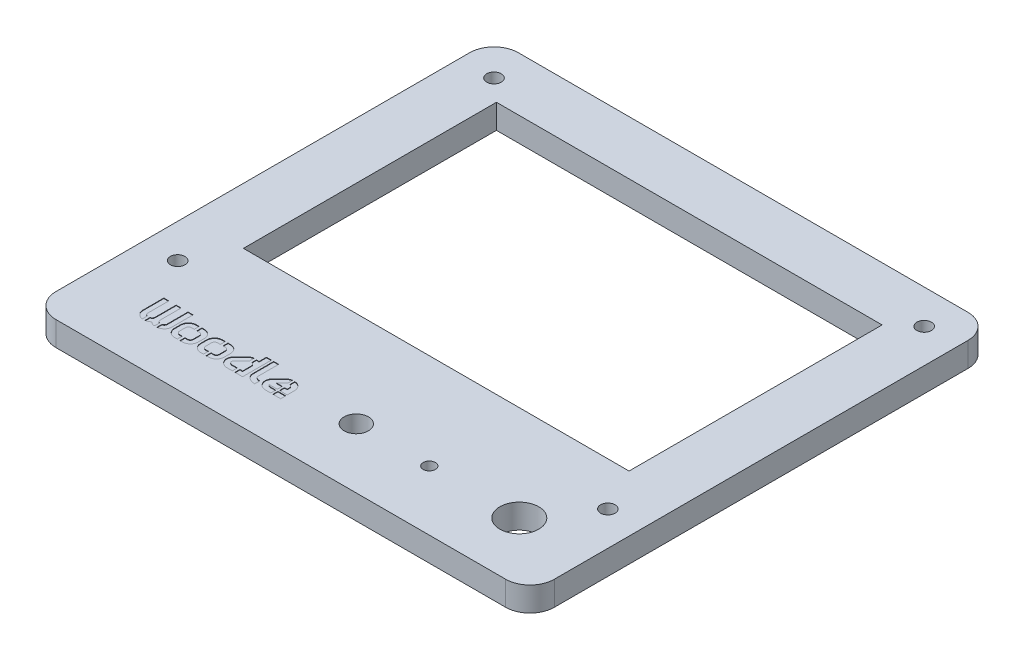
from build123d import *

# Parameters (mm, degrees)
SKETCH1_W           = 102.4
SKETCH1_H           = 95
SKETCH1_R           = 4
SKETCH1_R_2         = 1.5
SKETCH1_R_3         = 2.5
SKETCH1_R_4         = 1.25
SKETCH1_W_2         = 79.25
SKETCH1_H_2         = 52
BOSS_EXTRUDE1_DEPTH = 5
CUT_EXTRUDE1_DEPTH  = 0.1
FILLET1_R           = 5


with BuildPart() as part:
    # Sketch1 → Boss-Extrude1 (new body)
    with BuildSketch(Plane(origin=(0, 0, 0), x_dir=(1, 0, 0), z_dir=(0, 1, 0))):
        with Locations((0, -10.43)):
            Rectangle(SKETCH1_W, SKETCH1_H)
        with Locations(Location((36.7, -45.63, 0), (0, 0, 270))):
            Circle(SKETCH1_R, mode=Mode.SUBTRACT)
        with Locations(Location((-44.2, 30.07, 0), (0, 0, 270))):
            Circle(SKETCH1_R_2, mode=Mode.SUBTRACT)
        with Locations(Location((44.2, 30.07, 0), (0, 0, 270))):
            Circle(SKETCH1_R_2, mode=Mode.SUBTRACT)
        with Locations(Location((44.2, -34.93, 0), (0, 0, 270))):
            Circle(SKETCH1_R_2, mode=Mode.SUBTRACT)
        with Locations(Location((-44.2, -34.93, 0), (0, 0, 270))):
            Circle(SKETCH1_R_2, mode=Mode.SUBTRACT)
        with Locations(Location((3.2, -45.63, 0), (0, 0, 270))):
            Circle(SKETCH1_R_3, mode=Mode.SUBTRACT)
        with Locations(Location((18.2, -45.63, 0), (0, 0, 270))):
            Circle(SKETCH1_R_4, mode=Mode.SUBTRACT)
        Rectangle(SKETCH1_W_2, SKETCH1_H_2, mode=Mode.SUBTRACT)
    extrude(amount=BOSS_EXTRUDE1_DEPTH)

    # Sketch3 → Cut-Extrude1 (cut)
    with BuildSketch(Plane(origin=(0, 5, 0), x_dir=(1, 0, 0), z_dir=(0, 1, 0))):
        with BuildLine():
            add(Edge.make_bspline(
                [(-35.410526316, -47.317746711), (-35.409269236, -47.35079818), (-35.406784624, -47.416124246), (-35.381879918, -47.511001002), (-35.343551504, -47.601331044), (-35.289120642, -47.684190592), (-35.223509966, -47.758732759), (-35.145322275, -47.817499486), (-35.060801397, -47.866996704), (-34.998218698, -47.885603326), (-34.966447368, -47.895049342)],
                knots=[0, 0, 0, 0, 1.010227084, 1.996708827, 2.983833333, 4.003745822, 5.020232118, 6.007597553, 6.988517975, 8, 8, 8, 8], degree=3))
            Line((-34.966447368, -47.895049342), (-34.966447368, -48.93))
            add(Edge.make_bspline(
                [(-34.966447368, -48.93), (-35.012993201, -48.924417118), (-35.105344651, -48.913340138), (-35.241738224, -48.886497526), (-35.374212149, -48.847428211), (-35.503818383, -48.800067649), (-35.627944809, -48.740753756), (-35.746368401, -48.671724001), (-35.856804681, -48.589717308), (-35.924235419, -48.527267245), (-35.958223684, -48.495789474)],
                knots=[0, 0, 0, 0, 1.018810117, 2.021418134, 3.017070451, 4.018163531, 5.0176195, 6.003232589, 6.993535249, 8, 8, 8, 8], degree=3))
            add(Edge.make_bspline(
                [(-35.958223684, -48.495789474), (-36.02707741, -48.55013275), (-36.16623187, -48.659961363), (-36.363162428, -48.765074712), (-36.528631145, -48.833696509), (-36.656309169, -48.877973545), (-36.788203382, -48.909782822), (-36.877926518, -48.923253558), (-36.922861842, -48.93)],
                knots=[0, 0, 0, 0, 1.470266527, 2.97143169, 3.726468338, 4.477360312, 5.237428497, 6, 6, 6, 6], degree=3))
            Line((-36.922861842, -48.93), (-36.922861842, -47.895049342))
            add(Edge.make_bspline(
                [(-36.922861842, -47.895049342), (-36.889927853, -47.885501774), (-36.824404491, -47.866506541), (-36.734256781, -47.81771223), (-36.649935714, -47.758667854), (-36.577025401, -47.68454888), (-36.515271174, -47.601963717), (-36.470284079, -47.511809264), (-36.441330557, -47.416554863), (-36.438345654, -47.350845635), (-36.436842105, -47.317746711)],
                knots=[0, 0, 0, 0, 1.01260259, 2.014609424, 3.018094582, 4.051204175, 5.07884678, 6.058940596, 7.022253355, 8, 8, 8, 8], degree=3))
            Line((-36.436842105, -47.317746711), (-36.436842105, -43.008947368))
            Line((-36.436842105, -43.008947368), (-35.410526316, -43.008947368))
            Line((-35.410526316, -43.008947368), (-35.410526316, -47.317746711))
        make_face()
        with BuildLine():
            add(Edge.make_bspline(
                [(-32.963157895, -47.317746711), (-32.964801005, -47.369602358), (-32.968046871, -47.472040076), (-32.98727632, -47.624017964), (-33.024059613, -47.770618271), (-33.071860088, -47.912751867), (-33.132228537, -48.048841107), (-33.205338686, -48.176777092), (-33.288386095, -48.297890502), (-33.3832135, -48.409698478), (-33.488899271, -48.512497379), (-33.603258926, -48.606316279), (-33.727948807, -48.689906632), (-33.86181299, -48.761461736), (-34.002635133, -48.82452776), (-34.15121707, -48.871105124), (-34.304578797, -48.909979576), (-34.409915143, -48.923278165), (-34.463157895, -48.93)],
                knots=[0, 0, 0, 0, 1.028666461, 2.032068855, 3.03088781, 4.021147977, 5.003147261, 5.978214699, 6.939579792, 7.911675967, 8.88048293, 9.859905496, 10.84149838, 11.852230519, 12.867361305, 13.896318637, 14.936684362, 16, 16, 16, 16], degree=3))
            Line((-34.463157895, -48.93), (-34.463157895, -47.895049342))
            add(Edge.make_bspline(
                [(-34.463157895, -47.895049342), (-34.430211101, -47.885536669), (-34.365013133, -47.86671217), (-34.275919772, -47.818010073), (-34.193898432, -47.758507914), (-34.123271987, -47.684506294), (-34.06439912, -47.601494426), (-34.019874097, -47.511975309), (-33.994672793, -47.41614185), (-33.991219169, -47.350780677), (-33.989473684, -47.317746711)],
                knots=[0, 0, 0, 0, 1.022011913, 2.022445629, 3.015379681, 4.040857925, 5.06368216, 6.04744906, 7.013167921, 8, 8, 8, 8], degree=3))
            Line((-33.989473684, -47.317746711), (-33.989473684, -43.008947368))
            Line((-33.989473684, -43.008947368), (-32.963157895, -43.008947368))
            Line((-32.963157895, -43.008947368), (-32.963157895, -47.317746711))
        make_face()
        with BuildLine():
            add(Edge.make_bspline(
                [(-37.936842105, -47.317746711), (-37.935120096, -47.35079055), (-37.931712919, -47.416171258), (-37.906213049, -47.511686672), (-37.86325985, -47.601415851), (-37.805562279, -47.684858033), (-37.734808468, -47.758424076), (-37.652661119, -47.818380818), (-37.562459452, -47.86667324), (-37.496498966, -47.885521902), (-37.463157895, -47.895049342)],
                knots=[0, 0, 0, 0, 0.985573412, 1.950060536, 2.927269449, 3.941761156, 4.965931442, 5.957599044, 6.967626846, 8, 8, 8, 8], degree=3))
            Line((-37.463157895, -47.895049342), (-37.463157895, -48.93))
            add(Edge.make_bspline(
                [(-37.463157895, -48.93), (-37.513937746, -48.923254755), (-37.614789329, -48.909858326), (-37.76196025, -48.870947502), (-37.905547025, -48.824230369), (-38.04246227, -48.761600462), (-38.173090491, -48.688841116), (-38.297314104, -48.606534433), (-38.411593264, -48.511709109), (-38.519762405, -48.409914843), (-38.616761244, -48.297560219), (-38.703808224, -48.177002624), (-38.780180862, -48.048650256), (-38.845983798, -47.91322325), (-38.897530708, -47.770914548), (-38.936316648, -47.624126352), (-38.958949857, -47.472234993), (-38.961744677, -47.369629712), (-38.963157895, -47.317746711)],
                knots=[0, 0, 0, 0, 1.02041224, 2.026594961, 3.029967857, 4.028101524, 5.022727038, 6.009617966, 6.994326862, 7.980161472, 8.968175627, 9.948917217, 10.941614734, 11.942707234, 12.946482016, 13.954700296, 14.96578142, 16, 16, 16, 16], degree=3))
            Line((-38.963157895, -47.317746711), (-38.963157895, -43.008947368))
            Line((-38.963157895, -43.008947368), (-37.936842105, -43.008947368))
            Line((-37.936842105, -43.008947368), (-37.936842105, -47.317746711))
        make_face()
        with BuildLine():
            add(Edge.make_bspline(
                [(-30.806907895, -45.456315789), (-30.850723382, -45.458284893), (-30.936913644, -45.462158354), (-31.060957813, -45.497765045), (-31.174096916, -45.55726952), (-31.274111402, -45.637091712), (-31.358408414, -45.732009563), (-31.418461666, -45.840376686), (-31.456202659, -45.957560652), (-31.460815537, -46.039092601), (-31.463157895, -46.080493421)],
                knots=[0, 0, 0, 0, 1.043825976, 2.053329579, 3.049585033, 4.076299473, 5.091651461, 6.058032298, 7.013895072, 8, 8, 8, 8], degree=3))
            Line((-31.463157895, -46.080493421), (-31.463157895, -47.295542763))
            add(Edge.make_bspline(
                [(-31.463157895, -47.295542763), (-31.460755719, -47.335695536), (-31.456000756, -47.415175521), (-31.418805107, -47.529422126), (-31.357467061, -47.634470042), (-31.274540009, -47.728057399), (-31.173569002, -47.805084689), (-31.060910914, -47.863663436), (-30.93671203, -47.89750495), (-30.850692558, -47.901599864), (-30.806907895, -47.903684211)],
                knots=[0, 0, 0, 0, 0.968952361, 1.917982567, 2.870698946, 3.891457366, 4.918964356, 5.923292062, 6.942937516, 8, 8, 8, 8], degree=3))
            Line((-30.806907895, -47.903684211), (-30.277713816, -47.903684211))
            Line((-30.277713816, -47.903684211), (-30.277713816, -48.93))
            Line((-30.277713816, -48.93), (-30.806907895, -48.93))
            add(Edge.make_bspline(
                [(-30.806907895, -48.93), (-30.865775828, -48.92817462), (-30.981513408, -48.924585823), (-31.152412386, -48.901096276), (-31.316514628, -48.85970599), (-31.47472573, -48.804906279), (-31.622905189, -48.733980064), (-31.762743284, -48.653867232), (-31.891116993, -48.561052926), (-32.008948414, -48.457010453), (-32.115213567, -48.342150481), (-32.209695978, -48.216405988), (-32.292036204, -48.080760065), (-32.362743105, -47.936016143), (-32.419324745, -47.783657058), (-32.460484621, -47.625045637), (-32.48402667, -47.460721441), (-32.487641009, -47.349480923), (-32.489473684, -47.293075658)],
                knots=[0, 0, 0, 0, 1.080806525, 2.124924803, 3.159392374, 4.183645534, 5.193357222, 6.170922564, 7.138880151, 8.096181651, 9.052411011, 10.006611931, 10.978916479, 11.961395482, 12.959812438, 13.957687, 14.964431228, 16, 16, 16, 16], degree=3))
            Line((-32.489473684, -47.293075658), (-32.489473684, -46.075559211))
            add(Edge.make_bspline(
                [(-32.489473684, -46.075559211), (-32.487646725, -46.017919631), (-32.484042913, -45.904221284), (-32.460410138, -45.736255398), (-32.419819282, -45.57457679), (-32.362400138, -45.420051895), (-32.292365405, -45.273367094), (-32.210008194, -45.136407558), (-32.115202484, -45.010443075), (-32.008892646, -44.895675345), (-31.891531839, -44.791359845), (-31.762243298, -44.700311868), (-31.623571983, -44.619287783), (-31.474269541, -44.551826445), (-31.316538718, -44.497575009), (-31.152218857, -44.458112978), (-30.98157068, -44.433767538), (-30.865789053, -44.431270087), (-30.806907895, -44.43)],
                knots=[0, 0, 0, 0, 1.053003276, 2.077127084, 3.091951553, 4.09252401, 5.083718505, 6.05768351, 7.007210062, 7.958755116, 8.911367059, 9.870208281, 10.842984798, 11.841440058, 12.858208903, 13.885825724, 14.924829153, 16, 16, 16, 16], degree=3))
            Line((-30.806907895, -44.43), (-30.277713816, -44.43))
            Line((-30.277713816, -44.43), (-30.277713816, -45.456315789))
            Line((-30.277713816, -45.456315789), (-30.806907895, -45.456315789))
        make_face()
        with BuildLine():
            add(Edge.make_bspline(
                [(-29.235361842, -44.43), (-29.179364654, -44.431340086), (-29.068103292, -44.434002717), (-28.904306759, -44.457765462), (-28.745921582, -44.498020967), (-28.593475695, -44.551998405), (-28.448026802, -44.61967061), (-28.312138227, -44.69990226), (-28.186386682, -44.79187361), (-28.071370729, -44.895571736), (-27.967931328, -45.011300638), (-27.87265591, -45.135941642), (-27.792119257, -45.273786183), (-27.721710629, -45.419989593), (-27.664418487, -45.574593804), (-27.623793013, -45.736250792), (-27.600169525, -45.904222478), (-27.596564444, -46.017920033), (-27.594736842, -46.075559211)],
                knots=[0, 0, 0, 0, 1.037637347, 2.061691803, 3.059976681, 4.062877695, 5.055208535, 6.029101085, 6.983469214, 7.938689241, 8.893909267, 9.857365668, 10.841701768, 11.847437394, 12.862688559, 13.892400818, 14.93154884, 16, 16, 16, 16], degree=3))
            Line((-27.594736842, -46.075559211), (-27.594736842, -47.293075658))
            add(Edge.make_bspline(
                [(-27.594736842, -47.293075658), (-27.596570143, -47.349480529), (-27.600185716, -47.460720271), (-27.623718735, -47.625050149), (-27.664912438, -47.783640284), (-27.721368479, -47.936078403), (-27.792441333, -48.080341786), (-27.872968634, -48.216874729), (-27.967921693, -48.341291739), (-28.071313391, -48.457113666), (-28.186807841, -48.560547476), (-28.311630464, -48.654267709), (-28.448706798, -48.733604735), (-28.593017171, -48.80471943), (-28.745949801, -48.859253188), (-28.904103621, -48.901447646), (-29.068163472, -48.924344134), (-29.179378317, -48.92810623), (-29.235361842, -48.93)],
                knots=[0, 0, 0, 0, 1.050812842, 2.072376829, 3.084940585, 4.098054719, 5.094996286, 6.077650631, 7.045897848, 8.005867735, 8.965837622, 9.929498483, 10.908233743, 11.912067335, 12.92254273, 13.927690681, 14.956837279, 16, 16, 16, 16], degree=3))
            Line((-29.235361842, -48.93), (-29.721381579, -48.93))
            Line((-29.721381579, -48.93), (-29.721381579, -47.903684211))
            Line((-29.721381579, -47.903684211), (-29.235361842, -47.903684211))
            add(Edge.make_bspline(
                [(-29.235361842, -47.903684211), (-29.194008327, -47.901671571), (-29.113164618, -47.897736979), (-28.996536772, -47.862981577), (-28.89080916, -47.805269608), (-28.796770707, -47.727438748), (-28.720584989, -47.633239274), (-28.661368572, -47.529309798), (-28.627318565, -47.414811143), (-28.623159265, -47.335641303), (-28.621052632, -47.295542763)],
                knots=[0, 0, 0, 0, 1.031941725, 2.01738583, 3.010730696, 4.025329363, 5.047861792, 6.023177512, 6.998763965, 8, 8, 8, 8], degree=3))
            Line((-28.621052632, -47.295542763), (-28.621052632, -46.080493421))
            add(Edge.make_bspline(
                [(-28.621052632, -46.080493421), (-28.623102911, -46.039147556), (-28.627130691, -45.957923504), (-28.661705842, -45.840472748), (-28.719686875, -45.733277635), (-28.797210792, -45.637684355), (-28.890267626, -45.557114849), (-28.996496471, -45.498460223), (-29.112947996, -45.461927659), (-29.193974968, -45.458213105), (-29.235361842, -45.456315789)],
                knots=[0, 0, 0, 0, 1.018371753, 2.00059374, 2.989808205, 4.00676471, 5.021087658, 6.006237912, 6.981628247, 8, 8, 8, 8], degree=3))
            Line((-29.235361842, -45.456315789), (-29.721381579, -45.456315789))
            Line((-29.721381579, -45.456315789), (-29.721381579, -44.43))
            Line((-29.721381579, -44.43), (-29.235361842, -44.43))
        make_face()
        with BuildLine():
            add(Edge.make_bspline(
                [(-25.438486842, -45.456315789), (-25.482302329, -45.458284893), (-25.568492592, -45.462158354), (-25.69253676, -45.497765045), (-25.805675864, -45.55726952), (-25.90569035, -45.637091712), (-25.989987361, -45.732009563), (-26.050040613, -45.840376686), (-26.087781606, -45.957560652), (-26.092394485, -46.039092601), (-26.094736842, -46.080493421)],
                knots=[0, 0, 0, 0, 1.043825976, 2.053329579, 3.049585033, 4.076299473, 5.091651461, 6.058032298, 7.013895072, 8, 8, 8, 8], degree=3))
            Line((-26.094736842, -46.080493421), (-26.094736842, -47.295542763))
            add(Edge.make_bspline(
                [(-26.094736842, -47.295542763), (-26.092334666, -47.335695536), (-26.087579703, -47.415175521), (-26.050384054, -47.529422126), (-25.989046008, -47.634470042), (-25.906118956, -47.728057399), (-25.80514795, -47.805084689), (-25.692489861, -47.863663436), (-25.568290977, -47.89750495), (-25.482271505, -47.901599864), (-25.438486842, -47.903684211)],
                knots=[0, 0, 0, 0, 0.968952361, 1.917982567, 2.870698946, 3.891457366, 4.918964356, 5.923292062, 6.942937516, 8, 8, 8, 8], degree=3))
            Line((-25.438486842, -47.903684211), (-24.909292763, -47.903684211))
            Line((-24.909292763, -47.903684211), (-24.909292763, -48.93))
            Line((-24.909292763, -48.93), (-25.438486842, -48.93))
            add(Edge.make_bspline(
                [(-25.438486842, -48.93), (-25.497354775, -48.92817462), (-25.613092355, -48.924585823), (-25.783991334, -48.901096276), (-25.948093576, -48.85970599), (-26.106304678, -48.804906279), (-26.254484136, -48.733980064), (-26.394322232, -48.653867232), (-26.52269594, -48.561052926), (-26.640527361, -48.457010453), (-26.746792514, -48.342150481), (-26.841274925, -48.216405988), (-26.923615152, -48.080760065), (-26.994322052, -47.936016143), (-27.050903692, -47.783657058), (-27.092063568, -47.625045637), (-27.115605618, -47.460721441), (-27.119219956, -47.349480923), (-27.121052632, -47.293075658)],
                knots=[0, 0, 0, 0, 1.080806525, 2.124924803, 3.159392374, 4.183645534, 5.193357222, 6.170922564, 7.138880151, 8.096181651, 9.052411011, 10.006611931, 10.978916479, 11.961395482, 12.959812438, 13.957687, 14.964431228, 16, 16, 16, 16], degree=3))
            Line((-27.121052632, -47.293075658), (-27.121052632, -46.075559211))
            add(Edge.make_bspline(
                [(-27.121052632, -46.075559211), (-27.119225673, -46.017919631), (-27.11562186, -45.904221284), (-27.091989085, -45.736255398), (-27.05139823, -45.57457679), (-26.993979086, -45.420051895), (-26.923944352, -45.273367094), (-26.841587142, -45.136407558), (-26.746781431, -45.010443075), (-26.640471594, -44.895675345), (-26.523110786, -44.791359845), (-26.393822245, -44.700311868), (-26.25515093, -44.619287783), (-26.105848489, -44.551826445), (-25.948117665, -44.497575009), (-25.783797804, -44.458112978), (-25.613149627, -44.433767538), (-25.497368, -44.431270087), (-25.438486842, -44.43)],
                knots=[0, 0, 0, 0, 1.053003276, 2.077127084, 3.091951553, 4.09252401, 5.083718505, 6.05768351, 7.007210062, 7.958755116, 8.911367059, 9.870208281, 10.842984798, 11.841440058, 12.858208903, 13.885825724, 14.924829153, 16, 16, 16, 16], degree=3))
            Line((-25.438486842, -44.43), (-24.909292763, -44.43))
            Line((-24.909292763, -44.43), (-24.909292763, -45.456315789))
            Line((-24.909292763, -45.456315789), (-25.438486842, -45.456315789))
        make_face()
        with BuildLine():
            add(Edge.make_bspline(
                [(-23.866940789, -44.43), (-23.810943601, -44.431340086), (-23.69968224, -44.434002717), (-23.535885706, -44.457765462), (-23.37750053, -44.498020967), (-23.225054642, -44.551998405), (-23.079605749, -44.61967061), (-22.943717175, -44.69990226), (-22.81796563, -44.79187361), (-22.702949677, -44.895571736), (-22.599510275, -45.011300638), (-22.504234858, -45.135941642), (-22.423698205, -45.273786183), (-22.353289576, -45.419989593), (-22.295997435, -45.574593804), (-22.25537196, -45.736250792), (-22.231748473, -45.904222478), (-22.228143392, -46.017920033), (-22.226315789, -46.075559211)],
                knots=[0, 0, 0, 0, 1.037637347, 2.061691803, 3.059976681, 4.062877695, 5.055208535, 6.029101085, 6.983469214, 7.938689241, 8.893909267, 9.857365668, 10.841701768, 11.847437394, 12.862688559, 13.892400818, 14.93154884, 16, 16, 16, 16], degree=3))
            Line((-22.226315789, -46.075559211), (-22.226315789, -47.293075658))
            add(Edge.make_bspline(
                [(-22.226315789, -47.293075658), (-22.22814909, -47.349480529), (-22.231764663, -47.460720271), (-22.255297682, -47.625050149), (-22.296491385, -47.783640284), (-22.352947427, -47.936078403), (-22.424020281, -48.080341786), (-22.504547582, -48.216874729), (-22.599500641, -48.341291739), (-22.702892338, -48.457113666), (-22.818386788, -48.560547476), (-22.943209412, -48.654267709), (-23.080285746, -48.733604735), (-23.224596119, -48.80471943), (-23.377528749, -48.859253188), (-23.535682568, -48.901447646), (-23.69974242, -48.924344134), (-23.810957265, -48.92810623), (-23.866940789, -48.93)],
                knots=[0, 0, 0, 0, 1.050812842, 2.072376829, 3.084940585, 4.098054719, 5.094996286, 6.077650631, 7.045897848, 8.005867735, 8.965837622, 9.929498483, 10.908233743, 11.912067335, 12.92254273, 13.927690681, 14.956837279, 16, 16, 16, 16], degree=3))
            Line((-23.866940789, -48.93), (-24.352960526, -48.93))
            Line((-24.352960526, -48.93), (-24.352960526, -47.903684211))
            Line((-24.352960526, -47.903684211), (-23.866940789, -47.903684211))
            add(Edge.make_bspline(
                [(-23.866940789, -47.903684211), (-23.825587274, -47.901671571), (-23.744743565, -47.897736979), (-23.62811572, -47.862981577), (-23.522388108, -47.805269608), (-23.428349654, -47.727438748), (-23.352163936, -47.633239274), (-23.292947519, -47.529309798), (-23.258897513, -47.414811143), (-23.254738213, -47.335641303), (-23.252631579, -47.295542763)],
                knots=[0, 0, 0, 0, 1.031941725, 2.01738583, 3.010730696, 4.025329363, 5.047861792, 6.023177512, 6.998763965, 8, 8, 8, 8], degree=3))
            Line((-23.252631579, -47.295542763), (-23.252631579, -46.080493421))
            add(Edge.make_bspline(
                [(-23.252631579, -46.080493421), (-23.254681859, -46.039147556), (-23.258709639, -45.957923504), (-23.293284789, -45.840472748), (-23.351265823, -45.733277635), (-23.428789739, -45.637684355), (-23.521846574, -45.557114849), (-23.628075419, -45.498460223), (-23.744526944, -45.461927659), (-23.825553916, -45.458213105), (-23.866940789, -45.456315789)],
                knots=[0, 0, 0, 0, 1.018371753, 2.00059374, 2.989808205, 4.00676471, 5.021087658, 6.006237912, 6.981628247, 8, 8, 8, 8], degree=3))
            Line((-23.866940789, -45.456315789), (-24.352960526, -45.456315789))
            Line((-24.352960526, -45.456315789), (-24.352960526, -44.43))
            Line((-24.352960526, -44.43), (-23.866940789, -44.43))
        make_face()
        with BuildLine():
            Line((-18.436842105, -47.903684211), (-17.884210526, -47.903684211))
            Line((-17.884210526, -47.903684211), (-17.884210526, -46.096529605))
            add(Edge.make_bspline(
                [(-17.884210526, -46.096529605), (-17.885978924, -46.058075895), (-17.889438852, -45.982839955), (-17.92061641, -45.874411238), (-17.970370367, -45.77410301), (-18.04019432, -45.684885285), (-18.12247978, -45.606933123), (-18.218686485, -45.548479096), (-18.323656075, -45.505965313), (-18.398638702, -45.494320932), (-18.436842105, -45.488388158)],
                knots=[0, 0, 0, 0, 1.022761326, 2.001065903, 2.98108702, 3.989187733, 5.004881638, 5.983983554, 6.97284623, 8, 8, 8, 8], degree=3))
            Line((-18.436842105, -45.488388158), (-18.436842105, -44.474407895))
            add(Edge.make_bspline(
                [(-18.436842105, -44.474407895), (-18.385795951, -44.477951784), (-18.28756894, -44.484771214), (-18.145157956, -44.503933724), (-18.010794486, -44.527974341), (-17.92592101, -44.554917075), (-17.884210526, -44.568157895)],
                knots=[0, 0, 0, 0, 1.091901524, 2.10112249, 3.066809764, 4, 4, 4, 4], degree=3))
            Line((-17.884210526, -44.568157895), (-17.884210526, -43.008947368))
            Line((-17.884210526, -43.008947368), (-16.857894737, -43.008947368))
            Line((-16.857894737, -43.008947368), (-16.857894737, -48.93))
            Line((-16.857894737, -48.93), (-18.436842105, -48.93))
            Line((-18.436842105, -48.93), (-18.436842105, -47.903684211))
        make_face()
        with BuildLine():
            add(Edge.make_bspline(
                [(-20.062664474, -48.93), (-20.118656293, -48.928150086), (-20.22948062, -48.924488561), (-20.393810018, -48.900961218), (-20.552965726, -48.859545395), (-20.707374486, -48.804580715), (-20.853445327, -48.733946936), (-20.991786041, -48.651908108), (-21.121130733, -48.558310329), (-21.241245519, -48.453351158), (-21.349994384, -48.337276182), (-21.446571195, -48.210486316), (-21.531718643, -48.074695064), (-21.604993531, -47.930169843), (-21.663272539, -47.777368481), (-21.703544385, -47.617090856), (-21.729101091, -47.450966281), (-21.732437607, -47.337988376), (-21.734128289, -47.280740132)],
                knots=[0, 0, 0, 0, 1.030836197, 2.040328881, 3.048259431, 4.053913456, 5.05270677, 6.030248274, 7.011417249, 7.987697692, 8.962392167, 9.934378662, 10.917298058, 11.909183209, 12.912983755, 13.920914305, 14.946484204, 16, 16, 16, 16], degree=3))
            add(Edge.make_bspline(
                [(-21.734128289, -47.280740132), (-21.732202724, -47.236659879), (-21.728307959, -47.147500504), (-21.704603597, -47.013476724), (-21.662590942, -46.879648562), (-21.60772934, -46.746703666), (-21.540386268, -46.617860358), (-21.462035994, -46.497403062), (-21.377795837, -46.383826478), (-21.313384151, -46.316307822), (-21.281414474, -46.282796053)],
                knots=[0, 0, 0, 0, 0.943171208, 1.907714943, 2.901026669, 3.938269626, 4.980869203, 6.00561774, 7.0101213, 8, 8, 8, 8], degree=3))
            add(Edge.make_bspline(
                [(-21.281414474, -46.282796053), (-21.169186704, -46.163544628), (-20.943369808, -45.923595221), (-20.595997199, -45.570606184), (-20.246077965, -45.22025803), (-20.015598663, -44.984876687), (-19.901069079, -44.867911184)],
                knots=[0, 0, 0, 0, 0.994061606, 2.000181492, 3.006251836, 4, 4, 4, 4], degree=3))
            add(Edge.make_bspline(
                [(-19.901069079, -44.867911184), (-19.875104202, -44.844463675), (-19.819461846, -44.794216002), (-19.72352666, -44.723712721), (-19.613710339, -44.655393457), (-19.490671065, -44.596764635), (-19.360988863, -44.546381304), (-19.229095316, -44.500446562), (-19.099209735, -44.464479429), (-19.012272237, -44.454484964), (-18.970970395, -44.449736842)],
                knots=[0, 0, 0, 0, 0.810069558, 1.735967344, 2.753782946, 3.801817255, 4.887904665, 5.975369697, 7.038148522, 8, 8, 8, 8], degree=3))
            Line((-18.970970395, -44.449736842), (-18.970970395, -45.464950658))
            add(Edge.make_bspline(
                [(-18.970970395, -45.464950658), (-19.00850123, -45.475144607), (-19.081432986, -45.494953987), (-19.139109301, -45.543682708), (-19.167105263, -45.567335526)],
                knots=[0, 0, 0, 0, 1.029204218, 2, 2, 2, 2], degree=3))
            add(Edge.make_bspline(
                [(-19.167105263, -45.567335526), (-19.251453165, -45.651161816), (-19.412518245, -45.81123086), (-19.641602694, -46.040617876), (-19.848776535, -46.24791723), (-20.035575688, -46.434064177), (-20.203292178, -46.60392671), (-20.357119768, -46.757255407), (-20.498920307, -46.899171759), (-20.589799169, -46.990036345), (-20.633799342, -47.034029605)],
                knots=[0, 0, 0, 0, 1.375948511, 2.627418722, 3.751050578, 4.767029082, 5.678724609, 6.513038083, 7.280068212, 8, 8, 8, 8], degree=3))
            add(Edge.make_bspline(
                [(-20.633799342, -47.034029605), (-20.646970007, -47.049522563), (-20.674518166, -47.081928101), (-20.700685267, -47.144296923), (-20.716974491, -47.217381679), (-20.718239132, -47.269941803), (-20.718914474, -47.298009868)],
                knots=[0, 0, 0, 0, 0.853961671, 1.78617196, 2.817775449, 4, 4, 4, 4], degree=3))
            add(Edge.make_bspline(
                [(-20.718914474, -47.298009868), (-20.716639756, -47.338208863), (-20.712181495, -47.416995603), (-20.673578812, -47.530212746), (-20.614091438, -47.635491661), (-20.529766649, -47.728020322), (-20.429400211, -47.805143617), (-20.316647471, -47.863647627), (-20.192473861, -47.897509098), (-20.106450908, -47.901601263), (-20.062664474, -47.903684211)],
                knots=[0, 0, 0, 0, 0.971104243, 1.903284826, 2.866750735, 3.882332976, 4.912121888, 5.918680039, 6.940589956, 8, 8, 8, 8], degree=3))
            Line((-20.062664474, -47.903684211), (-18.970970395, -47.903684211))
            Line((-18.970970395, -47.903684211), (-18.970970395, -48.93))
            Line((-18.970970395, -48.93), (-20.062664474, -48.93))
        make_face()
        with BuildLine():
            Line((-15.357894737, -43.008947368), (-15.357894737, -47.302944079))
            add(Edge.make_bspline(
                [(-15.357894737, -47.302944079), (-15.356954369, -47.32359625), (-15.355068229, -47.365019271), (-15.339542591, -47.42525682), (-15.316005273, -47.483313398), (-15.26953182, -47.557417062), (-15.189481408, -47.64384023), (-15.067299558, -47.734366075), (-14.916974359, -47.806523543), (-14.746012088, -47.863098287), (-14.557462414, -47.89786276), (-14.42670802, -47.901716608), (-14.359950658, -47.903684211)],
                knots=[0, 0, 0, 0, 0.485141942, 0.973071803, 1.454439018, 1.953739644, 3.022040114, 4.20395727, 5.510241927, 6.926347096, 8.430729922, 10, 10, 10, 10], degree=3))
            Line((-14.359950658, -47.903684211), (-14.359950658, -48.93))
            add(Edge.make_bspline(
                [(-14.359950658, -48.93), (-14.428702657, -48.928832605), (-14.565019559, -48.926517972), (-14.766184329, -48.900290772), (-14.961937329, -48.861581435), (-15.149970522, -48.806008531), (-15.328626537, -48.73670986), (-15.49663307, -48.657257547), (-15.651680506, -48.565314234), (-15.794304032, -48.463169771), (-15.922376968, -48.349101195), (-16.038729391, -48.226541898), (-16.139615372, -48.092451058), (-16.228219976, -47.950180033), (-16.29664057, -47.798051486), (-16.348241615, -47.640783821), (-16.378556267, -47.477629177), (-16.382316171, -47.367211017), (-16.384210526, -47.311578947)],
                knots=[0, 0, 0, 0, 1.148217981, 2.276610438, 3.3842901, 4.480099663, 5.548133976, 6.583851855, 7.581963842, 8.55645292, 9.510525177, 10.443835217, 11.375575775, 12.310073828, 13.238692883, 14.155672564, 15.070771048, 16, 16, 16, 16], degree=3))
            Line((-16.384210526, -47.311578947), (-16.384210526, -43.008947368))
            Line((-16.384210526, -43.008947368), (-15.357894737, -43.008947368))
        make_face()
        with BuildLine():
            Line((-12.235773026, -46.561578947), (-11.084868421, -46.561578947))
            Line((-11.084868421, -46.561578947), (-11.084868421, -47.587894737))
            Line((-11.084868421, -47.587894737), (-12.773601974, -47.587894737))
            add(Edge.make_bspline(
                [(-12.773601974, -47.587894737), (-12.760746133, -47.610175599), (-12.734466538, -47.655721595), (-12.680624594, -47.715993979), (-12.614781224, -47.769506437), (-12.539449501, -47.817395902), (-12.453987671, -47.854957367), (-12.363148521, -47.883779101), (-12.266744137, -47.89964473), (-12.201286356, -47.902320553), (-12.167927632, -47.903684211)],
                knots=[0, 0, 0, 0, 0.860078926, 1.758152369, 2.687688369, 3.696714125, 4.738770742, 5.806285518, 6.882034885, 8, 8, 8, 8], degree=3))
            Line((-12.167927632, -47.903684211), (-11.084868421, -47.903684211))
            Line((-11.084868421, -47.903684211), (-11.084868421, -48.93))
            Line((-11.084868421, -48.93), (-12.167927632, -48.93))
            add(Edge.make_bspline(
                [(-12.167927632, -48.93), (-12.226379022, -48.928127505), (-12.342101612, -48.924420322), (-12.51266064, -48.901376938), (-12.676332654, -48.8597111), (-12.833234904, -48.804789999), (-12.98119584, -48.734061126), (-13.119492438, -48.651402929), (-13.24777334, -48.557456821), (-13.3633622, -48.45066442), (-13.469458291, -48.334706791), (-13.561005892, -48.206950433), (-13.643726469, -48.071390767), (-13.714153589, -47.92634776), (-13.769110913, -47.771913107), (-13.810621971, -47.611086215), (-13.833898693, -47.44342427), (-13.837543637, -47.329738478), (-13.839391447, -47.272105263)],
                knots=[0, 0, 0, 0, 1.069398265, 2.117204337, 3.140644575, 4.15411307, 5.153386037, 6.135065398, 7.097890291, 8.056209303, 9.009467126, 9.967845176, 10.926311773, 11.912017256, 12.911318532, 13.920170855, 14.945626909, 16, 16, 16, 16], degree=3))
            add(Edge.make_bspline(
                [(-13.839391447, -47.272105263), (-13.838461767, -47.228004681), (-13.836600342, -47.139705617), (-13.813493354, -47.009145023), (-13.782773683, -46.879167226), (-13.734334453, -46.753605792), (-13.680159617, -46.631364923), (-13.617905448, -46.517083207), (-13.552886521, -46.409785838), (-13.504354029, -46.343732095), (-13.480427632, -46.311167763)],
                knots=[0, 0, 0, 0, 1.012978646, 2.028206055, 3.041978951, 4.080201473, 5.117217361, 6.115746689, 7.071067793, 8, 8, 8, 8], degree=3))
            Line((-13.480427632, -46.311167763), (-11.997697368, -44.850641447))
            add(Edge.make_bspline(
                [(-11.997697368, -44.850641447), (-11.968241949, -44.822439266), (-11.908643111, -44.765376176), (-11.80801893, -44.691152104), (-11.699727961, -44.62246834), (-11.583909558, -44.561625011), (-11.462481288, -44.509554159), (-11.338019393, -44.470523329), (-11.212190586, -44.442094401), (-11.127353992, -44.434035727), (-11.084868421, -44.43)],
                knots=[0, 0, 0, 0, 0.953525925, 1.929323628, 2.919815636, 3.952913488, 4.987802582, 6.007365816, 7.002102776, 8, 8, 8, 8], degree=3))
            Line((-11.084868421, -44.43), (-11.084868421, -45.469884868))
            add(Edge.make_bspline(
                [(-11.084868421, -45.469884868), (-11.101976594, -45.471863128), (-11.136043953, -45.47580242), (-11.183819649, -45.498302723), (-11.231747647, -45.525303482), (-11.258535983, -45.552209018), (-11.272368421, -45.566101974)],
                knots=[0, 0, 0, 0, 0.95251899, 1.896743027, 2.913961255, 4, 4, 4, 4], degree=3))
            Line((-11.272368421, -45.566101974), (-12.235773026, -46.561578947))
        make_face()
        with BuildLine():
            Line((-9.042105263, -47.587894737), (-10.621052632, -47.587894737))
            Line((-10.621052632, -47.587894737), (-10.621052632, -46.561578947))
            Line((-10.621052632, -46.561578947), (-10.068421053, -46.561578947))
            Line((-10.068421053, -46.561578947), (-10.068421053, -46.100230263))
            add(Edge.make_bspline(
                [(-10.068421053, -46.100230263), (-10.070261911, -46.060981418), (-10.073882666, -45.983783458), (-10.104306014, -45.872062473), (-10.155869797, -45.769184649), (-10.226781769, -45.677910147), (-10.309010095, -45.597225577), (-10.404655793, -45.536349846), (-10.508956819, -45.49242265), (-10.583244263, -45.479939028), (-10.621052632, -45.473585526)],
                knots=[0, 0, 0, 0, 1.029899045, 2.025692833, 3.016081045, 4.033726075, 5.04993663, 6.0267995, 6.99574562, 8, 8, 8, 8], degree=3))
            Line((-10.621052632, -45.473585526), (-10.621052632, -44.43))
            add(Edge.make_bspline(
                [(-10.621052632, -44.43), (-10.565855848, -44.433051991), (-10.457309019, -44.43905386), (-10.297807492, -44.466226517), (-10.145579357, -44.511360053), (-9.999762499, -44.570563784), (-9.861748561, -44.643558116), (-9.732120902, -44.727857336), (-9.60980119, -44.821700121), (-9.498628632, -44.928165885), (-9.394751712, -45.042598142), (-9.305212706, -45.169033511), (-9.226603358, -45.304827748), (-9.160706209, -45.449459319), (-9.106975356, -45.602013192), (-9.068943487, -45.761113226), (-9.046248439, -45.92646306), (-9.043499504, -46.038481233), (-9.042105263, -46.095296053)],
                knots=[0, 0, 0, 0, 1.042773734, 2.050659023, 3.045221338, 4.033801315, 5.01617864, 5.98696263, 6.94936676, 7.92101885, 8.888353777, 9.861739746, 10.838738351, 11.845786774, 12.856953046, 13.88653357, 14.928064891, 16, 16, 16, 16], degree=3))
            Line((-9.042105263, -46.095296053), (-9.042105263, -47.587894737))
        make_face()
        Polygon((-9.042105263, -47.903684211), (-9.0125, -48.93), (-10.621052632, -48.93), (-10.621052632, -47.903684211), align=None)
    extrude(amount=-CUT_EXTRUDE1_DEPTH, mode=Mode.SUBTRACT)

    # Fillet1
    fillet1_edges = [part.edges().sort_by_distance(p)[0] for p in [
        (-51.2, 2.5, -37.07),
        (51.2, 2.5, -37.07),
        (51.2, 2.5, 57.93),
        (-51.2, 2.5, 57.93),
    ]]
    fillet(fillet1_edges, radius=FILLET1_R)


solid = part.part
